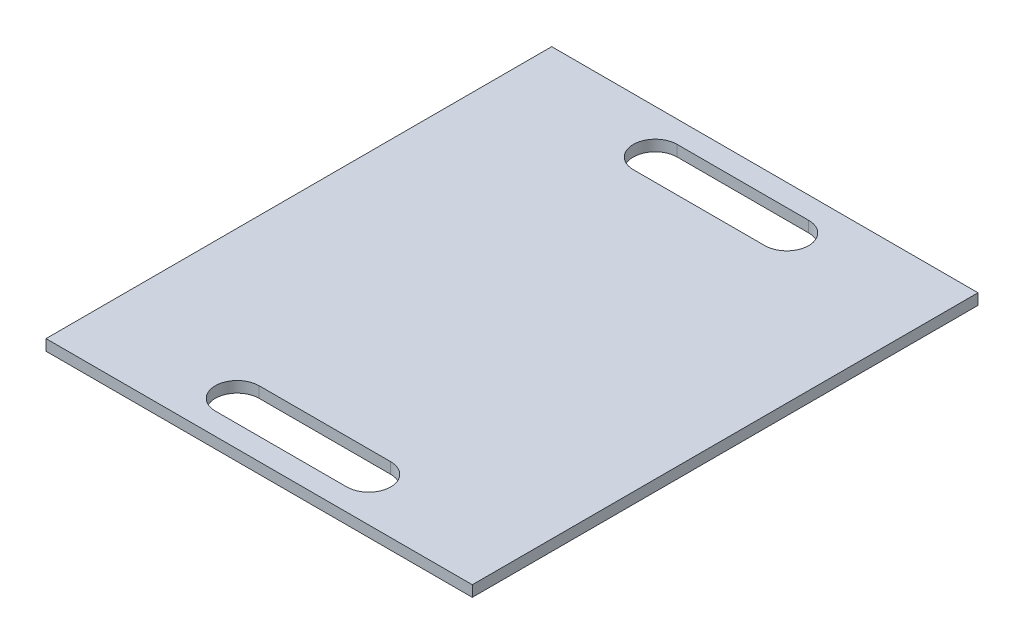
from build123d import *

# Parameters (mm, degrees)
SKETCH1_W       = 247
SKETCH1_H       = 293
MAIN_BASE_DEPTH = 3.175
HANDLES_DEPTH   = 192.715472772


with BuildPart() as part:
    # Sketch1 → Main Base (new, symmetric)
    with BuildSketch(Plane(origin=(0, 0, 0), x_dir=(1, 0, 0), z_dir=(0, 1, 0))):
        Rectangle(SKETCH1_W, SKETCH1_H)
    extrude(amount=MAIN_BASE_DEPTH, both=True)

    # Sketch2 → Handles (cut, through all)
    with BuildSketch(Plane(origin=(0, 3.175, 0), x_dir=(1, 0, 0), z_dir=(0, 1, 0))):
        with BuildLine():
            Line((-38.1, 133.8), (38.1, 133.8))
            ThreePointArc((38.1, 133.8), (50.8, 121.1), (38.1, 108.4))
            Line((38.1, 108.4), (-38.1, 108.4))
            ThreePointArc((-38.1, 108.4), (-50.8, 121.1), (-38.1, 133.8))
        make_face()
        with BuildLine():
            Line((-38.1, -133.8), (38.1, -133.8))
            ThreePointArc((38.1, -133.8), (50.8, -121.1), (38.1, -108.4))
            Line((38.1, -108.4), (-38.1, -108.4))
            ThreePointArc((-38.1, -108.4), (-50.8, -121.1), (-38.1, -133.8))
        make_face()
    extrude(amount=-HANDLES_DEPTH, mode=Mode.SUBTRACT)


solid = part.part
